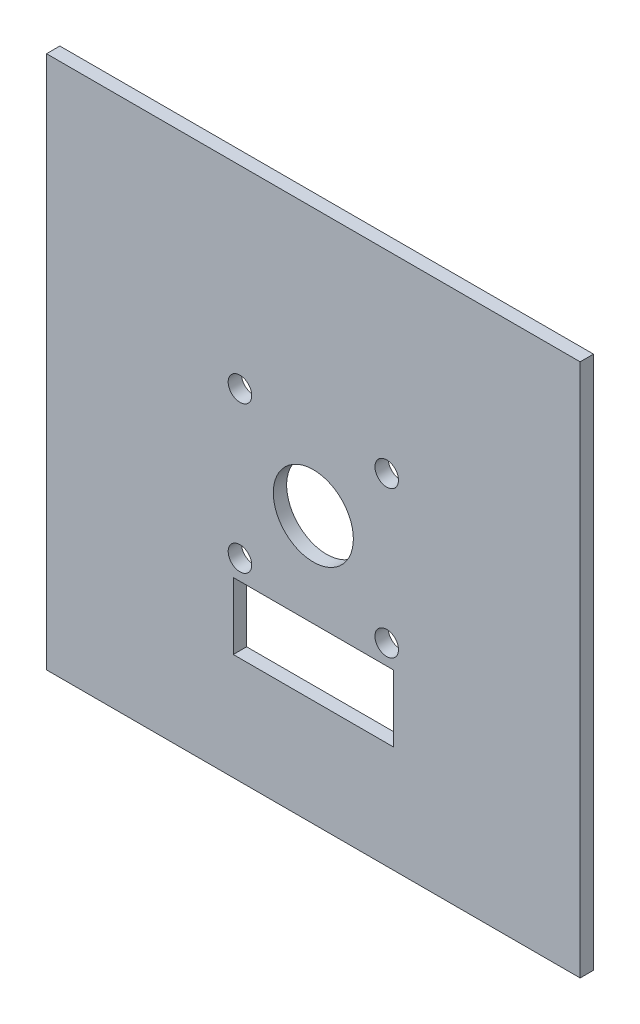
from build123d import *

# Parameters (mm, degrees)
SKETCH1_W           = 254
SKETCH1_H           = 254
SKETCH1_R           = 19.05
SKETCH1_R_2         = 5.603093475
SKETCH1_W_2         = 76.2
SKETCH1_H_2         = 31.75
BOSS_EXTRUDE1_DEPTH = 3.175


with BuildPart() as part:
    # Sketch1 → Boss-Extrude1 (new, symmetric)
    with BuildSketch(Plane.XY):
        Rectangle(SKETCH1_W, SKETCH1_H)
        Circle(SKETCH1_R, mode=Mode.SUBTRACT)
        with Locations((-34.925, 34.925)):
            Circle(SKETCH1_R_2, mode=Mode.SUBTRACT)
        with Locations((34.925, 34.925)):
            Circle(SKETCH1_R_2, mode=Mode.SUBTRACT)
        with Locations((-34.925, -34.925)):
            Circle(SKETCH1_R_2, mode=Mode.SUBTRACT)
        with Locations((34.925, -34.925)):
            Circle(SKETCH1_R_2, mode=Mode.SUBTRACT)
        with Locations((0, -60.325)):
            Rectangle(SKETCH1_W_2, SKETCH1_H_2, mode=Mode.SUBTRACT)
    extrude(amount=BOSS_EXTRUDE1_DEPTH, both=True)


solid = part.part
